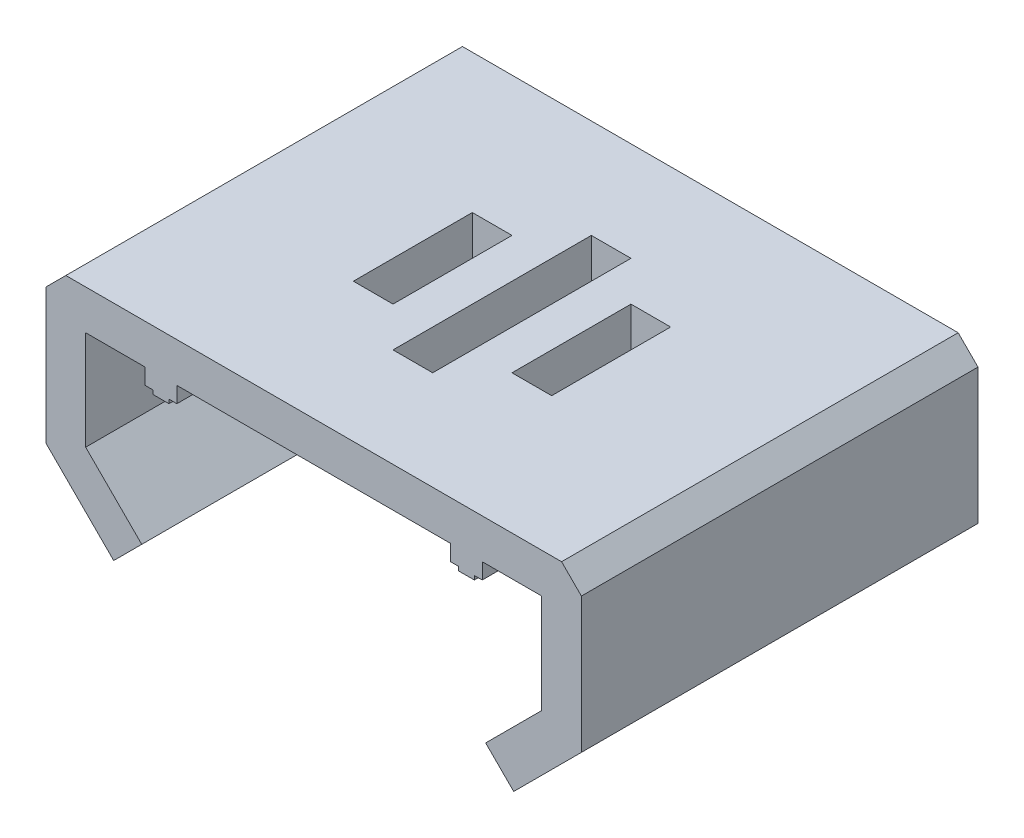
from build123d import *

# Parameters (mm, degrees)
BOSS_EXTRUDE1_DEPTH = 10
CHAMFER1_SIZE       = 0.5
SKETCH7_W           = 1
SKETCH7_H           = 3
SKETCH7_H_2         = 1
CUT_EXTRUDE1_DEPTH  = 14.310211959


with BuildPart() as part:
    # Sketch2 → Boss-Extrude1 (new body)
    with BuildSketch(Plane.XY):
        Polygon((4.25, 0), (5.75, 0), (5.75, -2.5), (4.335786438, -3.914213562), (5.042893219, -4.621320344), (6.75, -2.914213562), (6.75, 1), (0, 1), (0, 0), (3.45, 0), (3.45, -0.4), (3.65, -0.4), (3.65, -0.5), (4.05, -0.5), (4.05, -0.4), (4.25, -0.4), align=None)
    boss_extrude1 = extrude(amount=BOSS_EXTRUDE1_DEPTH)

    # Mirror1: Boss-Extrude1 across plane
    add(boss_extrude1.mirror(Plane(origin=(0, 0, 0), x_dir=(0, 0, 1), z_dir=(1, 0, 0))))

    # Chamfer1
    chamfer1_edges = [part.edges().sort_by_distance(p)[0] for p in [
        (6.75, 1, 5),
        (-6.75, 1, 5),
    ]]
    chamfer(chamfer1_edges, length=CHAMFER1_SIZE)

    # Sketch7 → Cut-Extrude1 (cut, through all)
    with BuildSketch(Plane(origin=(0, 1, 0), x_dir=(1, 0, 0), z_dir=(0, 1, 0))):
        with Locations((0, -5)):
            Rectangle(SKETCH7_W, SKETCH7_H)
        with Locations((0, -3)):
            Rectangle(SKETCH7_W, SKETCH7_H_2)
        with Locations((0, -7)):
            Rectangle(SKETCH7_W, SKETCH7_H_2)
        with Locations((2, -5)):
            Rectangle(SKETCH7_W, SKETCH7_H)
        with Locations((-2, -5)):
            Rectangle(SKETCH7_W, SKETCH7_H)
    extrude(amount=-CUT_EXTRUDE1_DEPTH, mode=Mode.SUBTRACT)


solid = part.part
